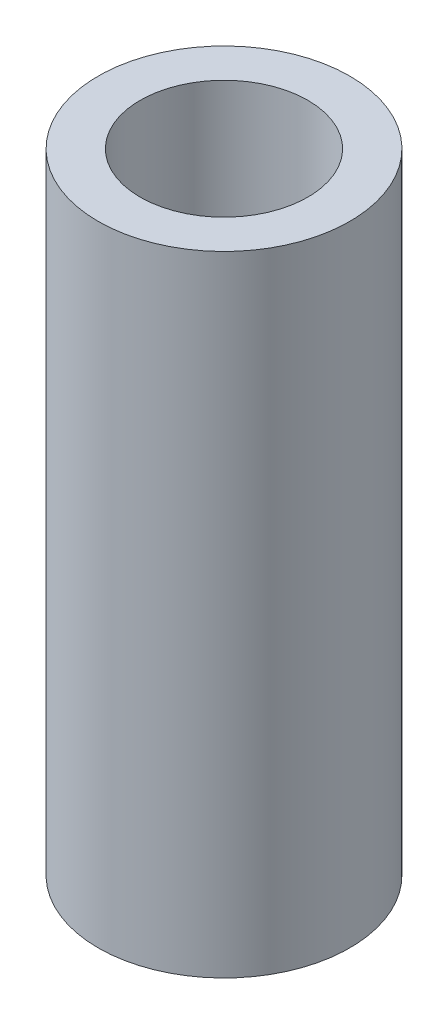
from build123d import *

# Parameters (mm, degrees)
SKETCH1_R           = 6
BOSS_EXTRUDE2_DEPTH = 30
SKETCH2_R           = 4
CUT_EXTRUDE1_DEPTH  = 10
SKETCH3_R           = 3
CUT_EXTRUDE2_DEPTH  = 10


with BuildPart() as part:
    # Sketch1 → Boss-Extrude2 (new body)
    with BuildSketch(Plane(origin=(0, 0, 0), x_dir=(1, 0, 0), z_dir=(0, 1, 0))):
        with Locations(Location((0, 0, 0), (0, 0, 270))):
            Circle(SKETCH1_R)
    extrude(amount=BOSS_EXTRUDE2_DEPTH)

    # Sketch2 → Cut-Extrude1 (cut)
    with BuildSketch(Plane(origin=(0, 30, 0), x_dir=(1, 0, 0), z_dir=(0, 1, 0))):
        with Locations(Location((0, 0, 0), (0, 0, 270))):
            Circle(SKETCH2_R)
    extrude(amount=-CUT_EXTRUDE1_DEPTH, mode=Mode.SUBTRACT)

    # Sketch3 → Cut-Extrude2 (cut)
    with BuildSketch(Plane(origin=(0, 0, 0), x_dir=(-1, 0, 0), z_dir=(0, -1, 0))):
        with Locations(Location((0, 0, 0), (0, 0, 90))):
            Circle(SKETCH3_R)
    extrude(amount=-CUT_EXTRUDE2_DEPTH, mode=Mode.SUBTRACT)


solid = part.part
